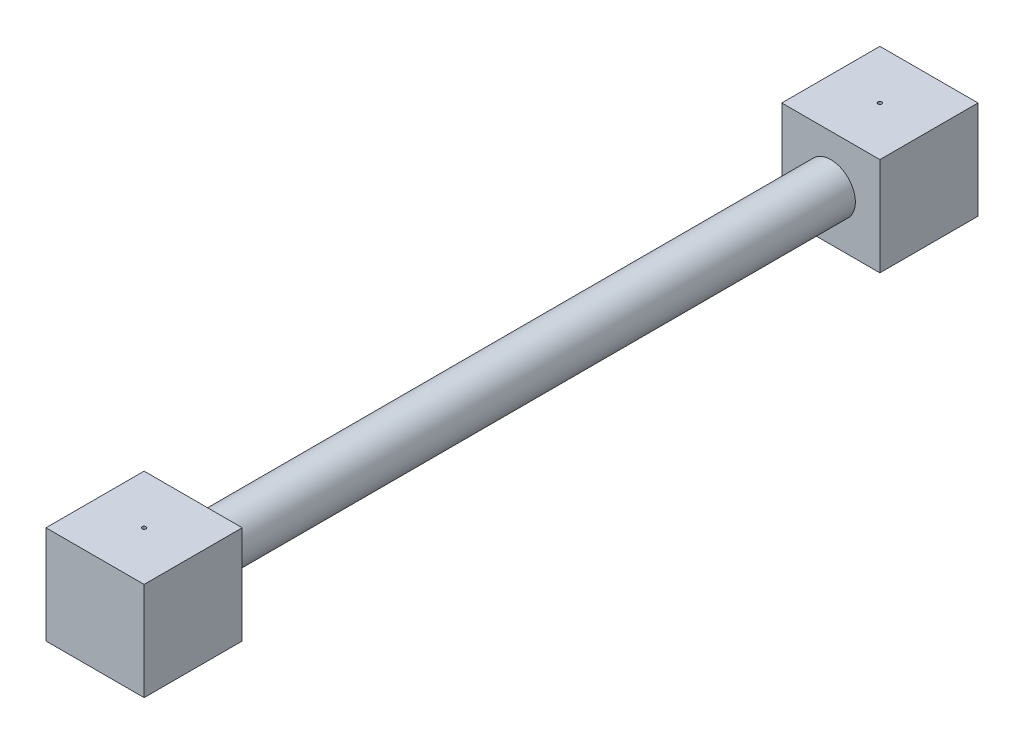
from build123d import *

# Parameters (mm, degrees)
SKETCH3_R           = 12.7
BOSS_EXTRUDE1_DEPTH = 381
SKETCH4_W           = 50.8
SKETCH4_H           = 50.8
BOSS_EXTRUDE2_DEPTH = 25.4
SKETCH5_W           = 50.8
SKETCH5_H           = 50.8
BOSS_EXTRUDE3_DEPTH = 25.4
SKETCH6_R           = 1.016
SKETCH6_R_2         = 0.9921875
CUT_EXTRUDE1_DEPTH  = 411.349558304


with BuildPart() as part:
    # Sketch3 → Boss-Extrude1 (new body)
    with BuildSketch(Plane.XY):
        Circle(SKETCH3_R)
    extrude(amount=BOSS_EXTRUDE1_DEPTH)

    # Sketch4 → Boss-Extrude2 (add, symmetric)
    with BuildSketch(Plane(origin=(0, 0, 0), x_dir=(-1, 0, 0), z_dir=(0, 0, -1))):
        Rectangle(SKETCH4_W, SKETCH4_H)
    extrude(amount=BOSS_EXTRUDE2_DEPTH, both=True)

    # Sketch5 → Boss-Extrude3 (add, symmetric)
    with BuildSketch(Plane.XY.offset(381)):
        Rectangle(SKETCH5_W, SKETCH5_H)
    extrude(amount=BOSS_EXTRUDE3_DEPTH, both=True)

    # Sketch6 → Cut-Extrude1 (cut, through all)
    with BuildSketch(Plane(origin=(0, 25.4, 0), x_dir=(1, 0, 0), z_dir=(0, 1, 0))):
        with Locations(Location((0, -381, 0), (0, 0, 270))):
            Circle(SKETCH6_R)
        with Locations(Location((0, 0, 0), (0, 0, 270))):
            Circle(SKETCH6_R_2)
    extrude(amount=-CUT_EXTRUDE1_DEPTH, mode=Mode.SUBTRACT)


solid = part.part
